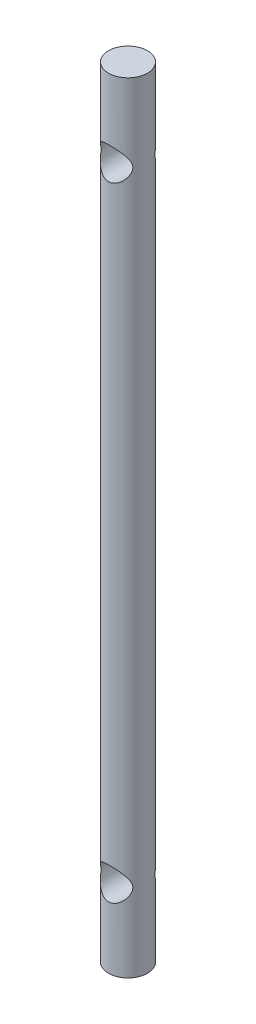
from build123d import *

# Parameters (mm, degrees)
SKETCH1_R               = 3.175
BOSS_EXTRUDE1_DEPTH     = 127
CUT_EXTRUDE1_DEPTH      = 127
CUT_EXTRUDE1_DEPTH_BACK = 127
SKETCH2_R               = 2.6035


with BuildPart() as part:
    # Sketch1 → Boss-Extrude1 (new body)
    with BuildSketch(Plane(origin=(0, 0, 0), x_dir=(1, 0, 0), z_dir=(0, 1, 0))):
        Circle(SKETCH1_R)
    extrude(amount=BOSS_EXTRUDE1_DEPTH)

    # Sketch2 → Cut-Extrude1 (cut, two sides: drawn at the far end of the back side and taken through both)
    with BuildSketch(Plane.XY.offset(-CUT_EXTRUDE1_DEPTH_BACK)):
        with Locations((0, 114.3)):
            Circle(SKETCH2_R)
        with Locations((0, 12.7)):
            Circle(SKETCH2_R)
    extrude(amount=CUT_EXTRUDE1_DEPTH + CUT_EXTRUDE1_DEPTH_BACK, mode=Mode.SUBTRACT)


solid = part.part
